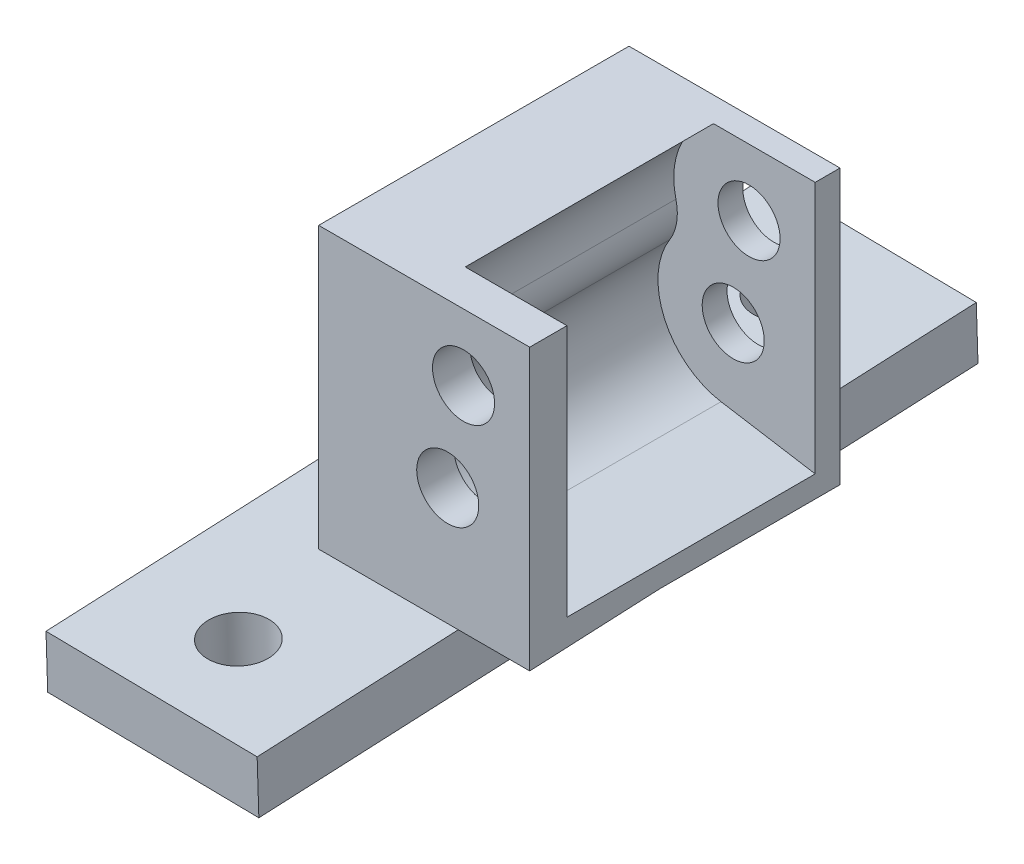
from build123d import *

# Parameters (mm, degrees)
BOSS_EXTRUDE1_DEPTH = 27.94
SKETCH2_W           = 21.59
SKETCH2_H           = 28.064626237
SKETCH2_R           = 3.175
BOSS_EXTRUDE2_DEPTH = 3.81
SKETCH3_R           = 3.175
BOSS_EXTRUDE3_DEPTH = 2.54
SKETCH4_W           = 21.59
SKETCH4_H           = 73.66
SKETCH4_R           = 3.175
BOSS_EXTRUDE4_DEPTH = 5.588
BOSS_EXTRUDE5_DEPTH = 21.59


with BuildPart() as part:
    # Sketch1 → Boss-Extrude1 (new body)
    with BuildSketch(Plane.XY):
        with BuildLine():
            ThreePointArc((-461.366897066, 277.506071532), (-460.543620658, 278.201967285), (-459.631228606, 278.776071532))
            Line((-459.631228606, 278.776071532), (-470.817858916, 278.776071532))
            Line((-470.817858916, 278.776071532), (-470.817858916, 250.711445295))
            Line((-470.817858916, 250.711445295), (-449.227858916, 250.711445295))
            Line((-449.227858916, 250.711445295), (-449.227858916, 252.940469765))
            Line((-449.227858916, 252.940469765), (-458.862647092, 254.521445295))
            ThreePointArc((-458.862647092, 254.521445295), (-461.281801172, 255.348530126), (-463.296789086, 256.922124572))
            ThreePointArc((-463.296789086, 256.922124572), (-463.938709782, 257.725469547), (-464.467858916, 258.607187485))
            ThreePointArc((-464.467858916, 258.607187485), (-465.307742726, 262.469481888), (-464.120754615, 266.239598875))
            ThreePointArc((-464.120754615, 266.239598875), (-463.399405765, 268.135304283), (-463.477224231, 270.162121354))
            ThreePointArc((-463.477224231, 270.162121354), (-463.397272377, 274.114329254), (-461.366897066, 277.506071532))
        make_face()
    extrude(amount=-BOSS_EXTRUDE1_DEPTH)

    # Sketch2 → Boss-Extrude2 (add)
    with BuildSketch(Plane.XY):
        with Locations((-460.022858916, 264.743758414)):
            Rectangle(SKETCH2_W, SKETCH2_H)
        with Locations(Location((-455.996603091, 271.987703521, 0), (0, 0, 180))):
            Circle(SKETCH2_R, mode=Mode.SUBTRACT)
        with Locations(Location((-457.615851502, 262.119672583, 0), (0, 0, 180))):
            Circle(SKETCH2_R, mode=Mode.SUBTRACT)
    extrude(amount=BOSS_EXTRUDE2_DEPTH)

    # Sketch3 → Boss-Extrude3 (add)
    with BuildSketch(Plane(origin=(0, 0, -25.4), x_dir=(-1, 0, 0), z_dir=(0, 0, -1))):
        with BuildLine():
            Line((449.227858916, 252.940469765), (449.227858916, 278.776071532))
            Line((449.227858916, 278.776071532), (459.631228606, 278.776071532))
            ThreePointArc((459.631228606, 278.776071532), (463.027763128, 275.12700781), (463.477224231, 270.162121354))
            ThreePointArc((463.477224231, 270.162121354), (463.399405765, 268.135304283), (464.120754615, 266.239598875))
            ThreePointArc((464.120754615, 266.239598875), (464.640877411, 258.967440337), (458.862647092, 254.521445295))
            Line((458.862647092, 254.521445295), (449.227858916, 252.940469765))
        make_face()
        with Locations((455.996603091, 271.987703521)):
            Circle(SKETCH3_R, mode=Mode.SUBTRACT)
        with Locations((457.615851502, 262.119672583)):
            Circle(SKETCH3_R, mode=Mode.SUBTRACT)
    extrude(amount=BOSS_EXTRUDE3_DEPTH)

    # Sketch4 → Boss-Extrude4 (add)
    with BuildSketch(Plane(origin=(3.845560936, 242.063082319, 11.417237821), x_dir=(0.9998741117550617, -0.01584934704377417, -0.0007475562269394038), z_dir=(0.01586696700779418, 0.9987637706378838, 0.04710806533037051))):
        with Locations((-471.560049375, 24.516249071)):
            Rectangle(SKETCH4_W, SKETCH4_H)
        with Locations(Location((-471.560049375, 52.456249071, 0), (0, 0, 270))):
            Circle(SKETCH4_R, mode=Mode.SUBTRACT)
        with Locations(Location((-471.560049375, -3.423750929, 0), (0, 0, 270))):
            Circle(SKETCH4_R, mode=Mode.SUBTRACT)
    extrude(amount=-BOSS_EXTRUDE4_DEPTH)

    # Sketch5 → Boss-Extrude5 (add)
    with BuildSketch(Plane.ZY.offset(470.817858916)):
        Polygon((3.81, 250.711445295), (3.81, 250.083908323), (-13.668693003, 250.908314891), align=None)
    extrude(amount=-BOSS_EXTRUDE5_DEPTH)


solid = part.part
